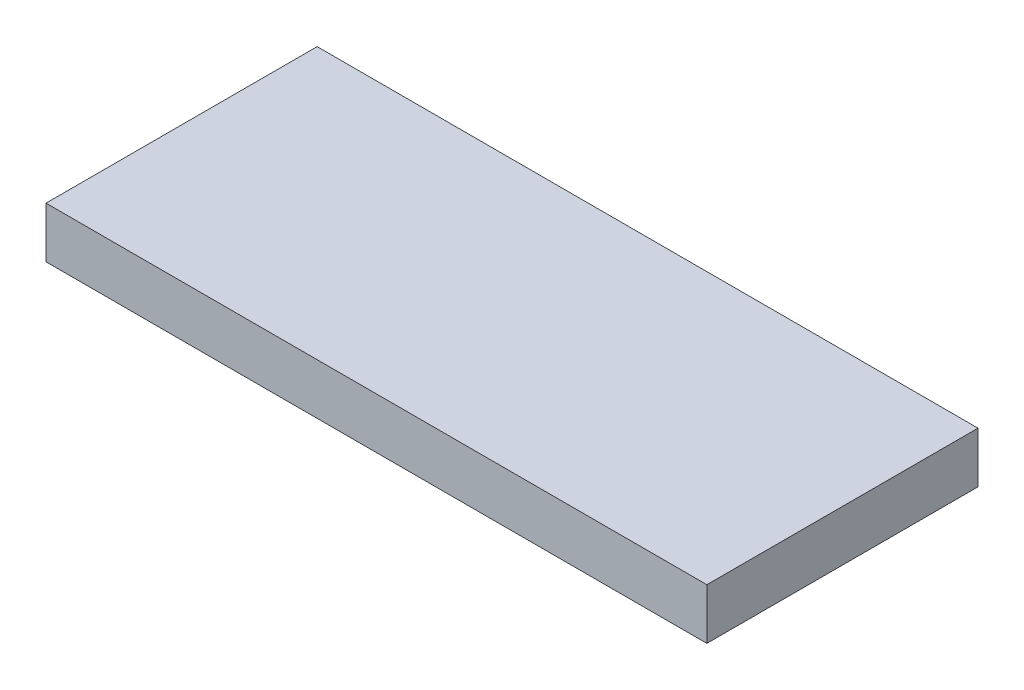
from build123d import *

# Parameters (mm, degrees)
SKETCH1_W           = 495.3
SKETCH1_H           = 203.2
BOSS_EXTRUDE1_DEPTH = 38.1


with BuildPart() as part:
    # Sketch1 → Boss-Extrude1 (new body)
    with BuildSketch(Plane(origin=(0, 0, 0), x_dir=(1, 0, 0), z_dir=(0, 1, 0))):
        Rectangle(SKETCH1_W, SKETCH1_H)
    extrude(amount=BOSS_EXTRUDE1_DEPTH)


solid = part.part
